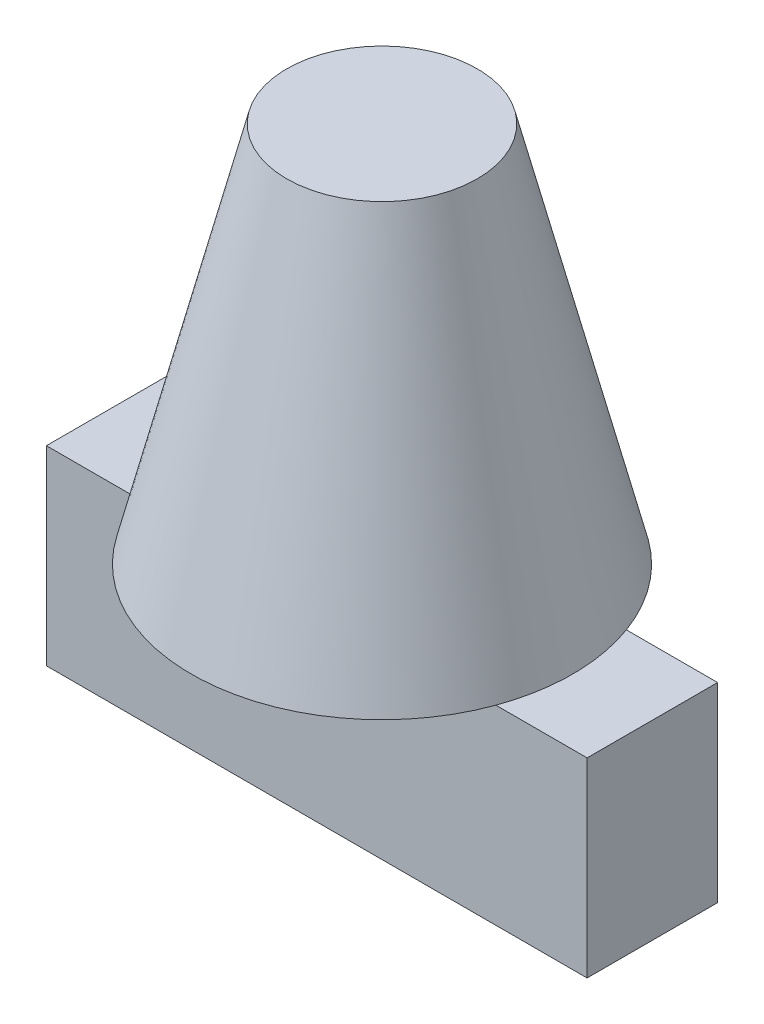
from build123d import *

# Parameters (mm, degrees)
SKETCH2_R           = 5
SKETCH1_R           = 10
SKETCH3_W           = 28.361759846
SKETCH3_H           = 6.844946114
BOSS_EXTRUDE1_DEPTH = 10


with BuildPart() as part:
    # Sketch2 → Loft1 section 0
    with BuildSketch(Plane(origin=(0, 20, 0), x_dir=(1, 0, 0), z_dir=(0, 1, 0))):
        Circle(SKETCH2_R)
    # Sketch1 → Loft1 section 1
    with BuildSketch(Plane(origin=(0, 0, 0), x_dir=(1, 0, 0), z_dir=(0, 1, 0))):
        Circle(SKETCH1_R)
    loft()

    # Sketch3 → Boss-Extrude1 (add)
    with BuildSketch(Plane.XZ):
        Rectangle(SKETCH3_W, SKETCH3_H)
    extrude(amount=BOSS_EXTRUDE1_DEPTH)


solid = part.part
